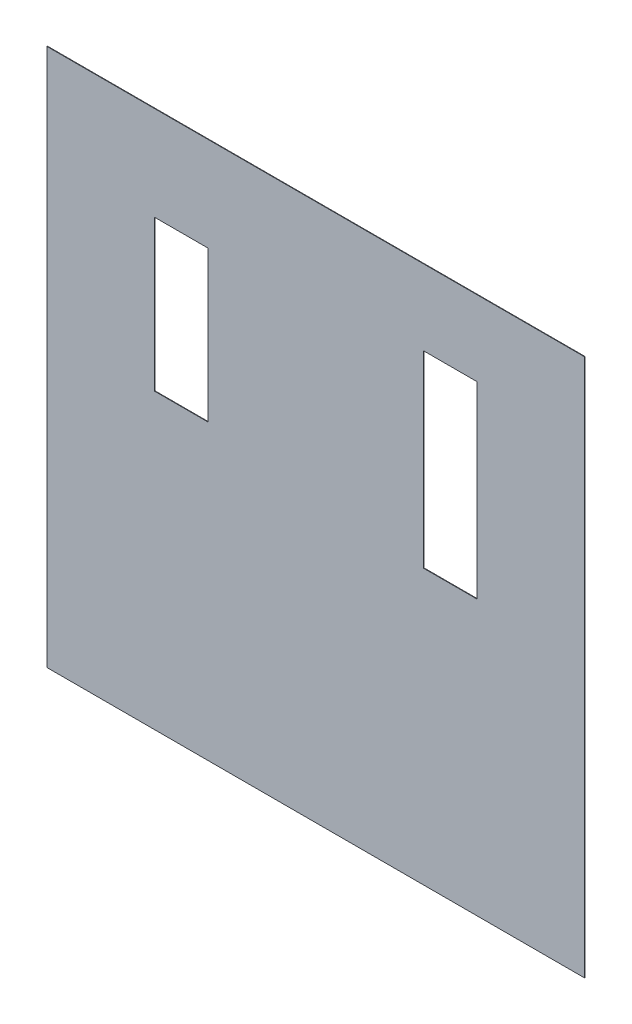
from build123d import *

# Parameters (mm, degrees)
SKETCH1_W           = 25.4
SKETCH1_H           = 25.4
BOSS_EXTRUDE1_DEPTH = 0.0254
SKETCH2_W           = 2.54
SKETCH2_H           = 7.112
SKETCH2_H_2         = 8.89
CUT_EXTRUDE1_DEPTH  = 36.921033465


with BuildPart() as part:
    # Sketch1 → Boss-Extrude1 (new body)
    with BuildSketch(Plane.XY):
        with Locations((12.7, 12.7)):
            Rectangle(SKETCH1_W, SKETCH1_H)
    extrude(amount=BOSS_EXTRUDE1_DEPTH)

    # Sketch2 → Cut-Extrude1 (cut, through all)
    with BuildSketch(Plane.XY.offset(0.0254)):
        with Locations((6.35, 17.399)):
            Rectangle(SKETCH2_W, SKETCH2_H)
        with Locations((19.05, 17.399)):
            Rectangle(SKETCH2_W, SKETCH2_H_2)
    extrude(amount=-CUT_EXTRUDE1_DEPTH, mode=Mode.SUBTRACT)


solid = part.part
